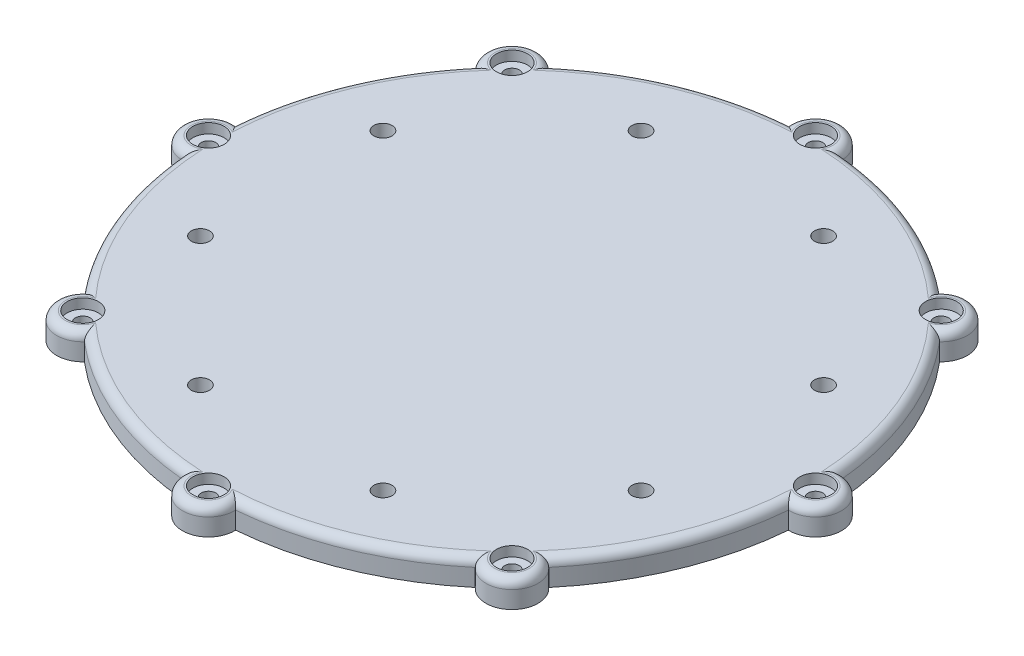
from build123d import *

# Parameters (mm, degrees)
BOSS_EXTRUDE2_DEPTH                              = 15
CBORE_FOR_M8_HEX_HEAD_BOLT1_D                    = 8.4
CBORE_FOR_M8_HEX_HEAD_BOLT1_CBORE_D              = 18.01
CBORE_FOR_M8_HEX_HEAD_BOLT1_CBORE_DEPTH          = 5.68
CIRPATTERN1_COUNT                                = 8
CSK_FOR_M10_FLAT_HEAD_MACHINE_SCREW1_D           = 10.5
CSK_FOR_M10_FLAT_HEAD_MACHINE_SCREW1_CSINK_D     = 20
CSK_FOR_M10_FLAT_HEAD_MACHINE_SCREW1_CSINK_ANGLE = 90
CIRPATTERN2_COUNT                                = 8
FILLET1_R                                        = 5


with BuildPart() as part:
    # Sketch1 → Boss-Extrude2 (new body)
    with BuildSketch(Plane(origin=(0, 0, 0), x_dir=(1, 0, 0), z_dir=(0, 1, 0))):
        with BuildLine():
            ThreePointArc((-133.885974547, 112.692261578), (-161.678918189, 66.969600664), (-174.357142857, 14.986218158))
            ThreePointArc((-174.357142857, 14.986218158), (-190, 0), (-174.357142857, -14.986218158))
            ThreePointArc((-174.357142857, -14.986218158), (-161.678918189, -66.969600664), (-133.885974547, -112.692261578))
            ThreePointArc((-133.885974547, -112.692261578), (-134.350288425, -134.350288425), (-112.692261578, -133.885974547))
            ThreePointArc((-112.692261578, -133.885974547), (-66.969600664, -161.678918189), (-14.986218158, -174.357142857))
            ThreePointArc((-14.986218158, -174.357142857), (0, -190), (14.986218158, -174.357142857))
            ThreePointArc((14.986218158, -174.357142857), (66.969600664, -161.678918189), (112.692261578, -133.885974547))
            ThreePointArc((112.692261578, -133.885974547), (134.350288425, -134.350288425), (133.885974547, -112.692261578))
            ThreePointArc((133.885974547, -112.692261578), (161.678918189, -66.969600664), (174.357142857, -14.986218158))
            ThreePointArc((174.357142857, -14.986218158), (190, 0), (174.357142857, 14.986218158))
            ThreePointArc((174.357142857, 14.986218158), (161.678918189, 66.969600664), (133.885974547, 112.692261578))
            ThreePointArc((133.885974547, 112.692261578), (134.350288425, 134.350288425), (112.692261578, 133.885974547))
            ThreePointArc((112.692261578, 133.885974547), (66.969600664, 161.678918189), (14.986218158, 174.357142857))
            ThreePointArc((14.986218158, 174.357142857), (0, 190), (-14.986218158, 174.357142857))
            ThreePointArc((-14.986218158, 174.357142857), (-66.969600664, 161.678918189), (-112.692261578, 133.885974547))
            ThreePointArc((-112.692261578, 133.885974547), (-134.350288425, 134.350288425), (-133.885974547, 112.692261578))
        make_face()
    extrude(amount=BOSS_EXTRUDE2_DEPTH)

    # CBORE for M8 Hex Head Bolt1 (through all)
    with Locations(Plane(origin=(0, 15, 0), x_dir=(1, 0, 0), z_dir=(0, 1, 0))):
        with Locations((0, 175)):
            cbore_for_m8_hex_head_bolt1 = CounterBoreHole(CBORE_FOR_M8_HEX_HEAD_BOLT1_D / 2, CBORE_FOR_M8_HEX_HEAD_BOLT1_CBORE_D / 2, CBORE_FOR_M8_HEX_HEAD_BOLT1_CBORE_DEPTH)

    # CirPattern1: CBORE for M8 Hex Head Bolt1 ×8 about axis
    cirpattern1_axis = Axis((0, 0, 0), (0, 1, 0))
    for i in range(1, CIRPATTERN1_COUNT):
        add(cbore_for_m8_hex_head_bolt1.rotate(cirpattern1_axis, i * 360 / CIRPATTERN1_COUNT), mode=Mode.SUBTRACT)

    # CSK for M10 Flat Head Machine Screw1 (through all)
    with Locations(Plane(origin=(-52.61897195, 0, -127.03343572), x_dir=(0, 0, -1), z_dir=(0, -1, 0))):
        with Locations((0, 0)):
            csk_for_m10_flat_head_machine_screw1 = CounterSinkHole(CSK_FOR_M10_FLAT_HEAD_MACHINE_SCREW1_D / 2, CSK_FOR_M10_FLAT_HEAD_MACHINE_SCREW1_CSINK_D / 2, counter_sink_angle=CSK_FOR_M10_FLAT_HEAD_MACHINE_SCREW1_CSINK_ANGLE)

    # CirPattern2: CSK for M10 Flat Head Machine Screw1 ×8 about axis
    cirpattern2_axis = Axis((0, 0, 0), (0, 1, 0))
    for i in range(1, CIRPATTERN2_COUNT):
        add(csk_for_m10_flat_head_machine_screw1.rotate(cirpattern2_axis, i * 360 / CIRPATTERN2_COUNT), mode=Mode.SUBTRACT)

    # Fillet1
    fillet1_edges = [part.edges().sort_by_distance(p)[0] for p in [
        (-190, 15, 0),
        (-161.678918189, 15, 66.969600664),
        (-134.350288425, 15, 134.350288425),
        (-66.969600664, 15, 161.678918189),
        (0, 15, 190),
        (66.969600664, 15, 161.678918189),
        (134.350288425, 15, 134.350288425),
        (161.678918189, 15, 66.969600664),
        (190, 15, 0),
        (161.678918189, 15, -66.969600664),
        (-134.350288425, 15, -134.350288425),
        (134.350288425, 15, -134.350288425),
        (66.969600664, 15, -161.678918189),
        (0, 15, -190),
        (-66.969600664, 15, -161.678918189),
        (-161.678918189, 15, -66.969600664),
    ]]
    fillet(fillet1_edges, radius=FILLET1_R)


solid = part.part
